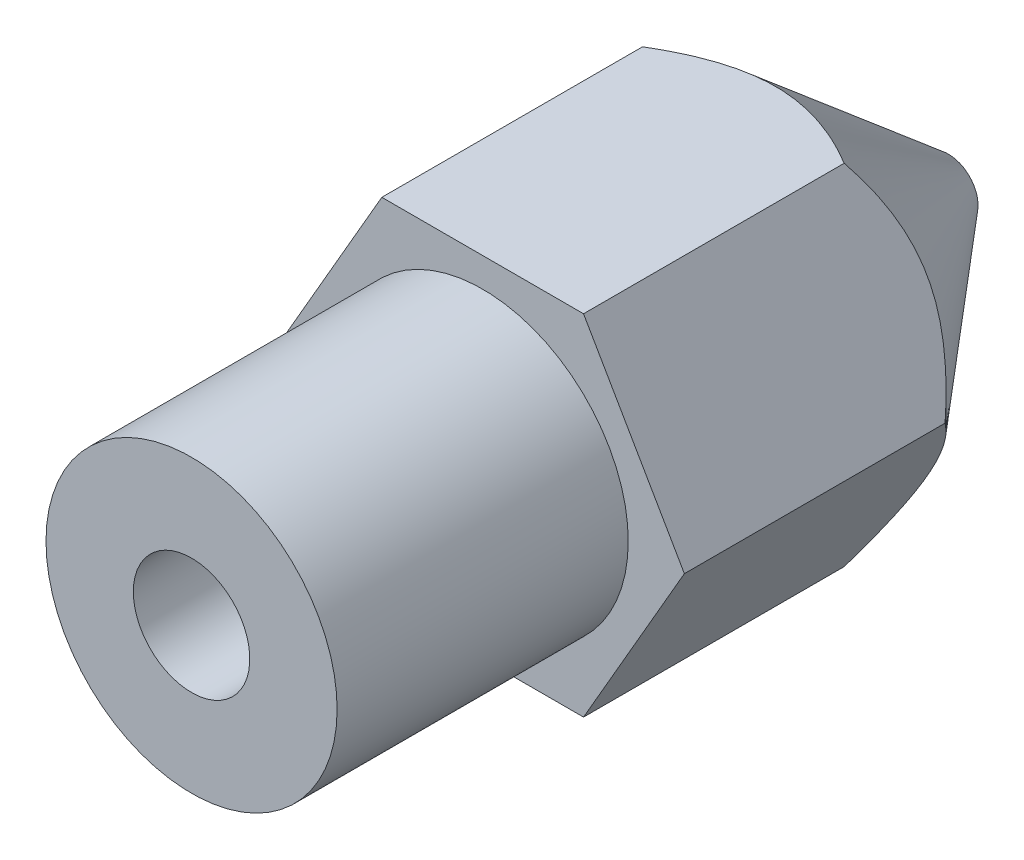
from build123d import *

# Parameters (mm, degrees)
BOSS_EXTRUDE1_DEPTH = 8
SKETCH3_R           = 2.5
BOSS_EXTRUDE2_DEPTH = 5


with BuildPart() as part:
    # Sketch1 → Boss-Extrude1 (new body)
    with BuildSketch(Plane.XY):
        Polygon((1.732050808, 3), (-1.732050808, 3), (-3.464101615, 0), (-1.732050808, -3), (1.732050808, -3), (3.464101615, 0), align=None)
    extrude(amount=BOSS_EXTRUDE1_DEPTH)

    # Sketch2 → Cut-Revolve1 (revolve, cut)
    with BuildSketch(Plane(origin=(0, 0, 0), x_dir=(1, 0, 0), z_dir=(0, 1, 0))):
        Polygon((-0.508, 0), (-3.464101615, -3.52294472), (-3.464101615, 0), align=None)
    revolve(axis=Axis((0, 0, 0), (0, 0, 1)), mode=Mode.SUBTRACT)

    # Sketch3 → Boss-Extrude2 (add)
    with BuildSketch(Plane.XY.offset(8)):
        Circle(SKETCH3_R)
    extrude(amount=BOSS_EXTRUDE2_DEPTH)

    # Sketch4 → Cut-Revolve2 (revolve, cut)
    with BuildSketch(Plane(origin=(0, 0, 0), x_dir=(1, 0, 0), z_dir=(0, 1, 0))):
        Polygon((0, 0), (0, -13), (-1, -13), (-1, -1.638256659), (-0.2, -1.212889113), (-0.2, 0), align=None)
    revolve(axis=Axis((0, 0, 0), (0, 0, 1)), mode=Mode.SUBTRACT)


solid = part.part
